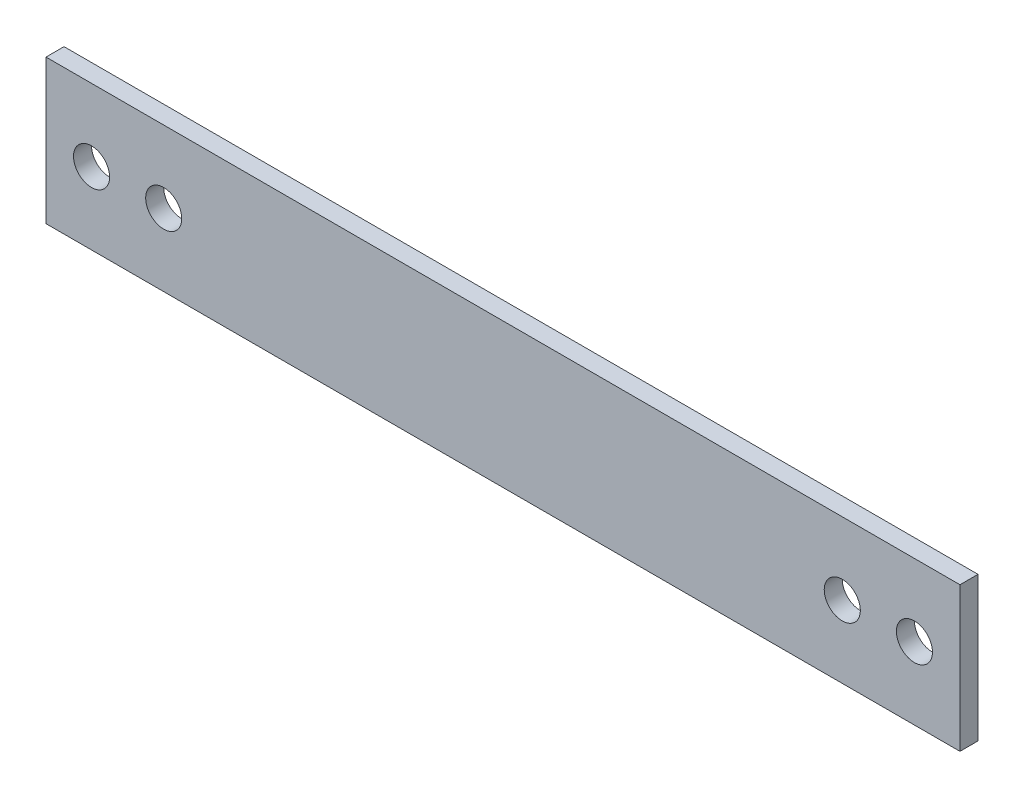
from build123d import *

# Parameters (mm, degrees)
SKETCH1_W           = 241.3
SKETCH1_H           = 38.1
SKETCH1_R           = 4.7625
BOSS_EXTRUDE1_DEPTH = 4.7625


with BuildPart() as part:
    # Sketch1 → Boss-Extrude1 (new body)
    with BuildSketch(Plane.XY):
        Rectangle(SKETCH1_W, SKETCH1_H)
        with Locations(Location((-108.625531915, 0, 0), (0, 0, 180))):
            Circle(SKETCH1_R, mode=Mode.SUBTRACT)
        with Locations(Location((-89.575531915, 0, 0), (0, 0, 180))):
            Circle(SKETCH1_R, mode=Mode.SUBTRACT)
        with Locations(Location((89.575531915, 0, 0), (0, 0, 180))):
            Circle(SKETCH1_R, mode=Mode.SUBTRACT)
        with Locations(Location((108.625531915, 0, 0), (0, 0, 180))):
            Circle(SKETCH1_R, mode=Mode.SUBTRACT)
    extrude(amount=BOSS_EXTRUDE1_DEPTH)


solid = part.part
